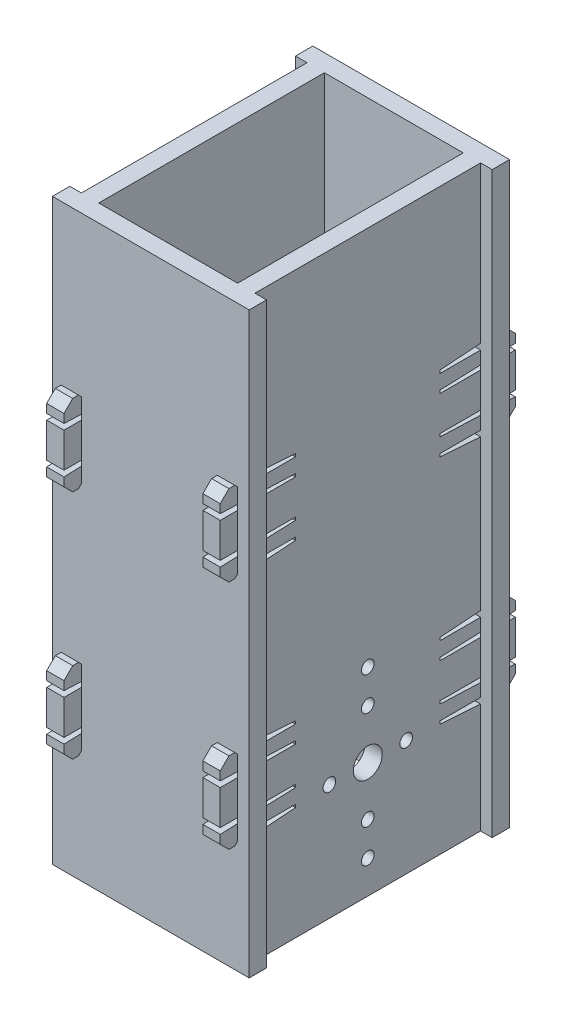
from build123d import *

# Parameters (mm, degrees)
SKETCH3_R           = 1.0922
SKETCH3_R_2         = 2.5
BOSS_EXTRUDE2_DEPTH = 3
SKETCH6_W           = 34
SKETCH6_H           = 100
SKETCH6_W_2         = 3
SKETCH6_H_2         = 12
BOSS_EXTRUDE3_DEPTH = 3


with BuildPart() as part:
    # Sketch3 → Boss-Extrude2 (new body)
    with BuildSketch(Plane.ZY.offset(-3)):
        Polygon((-42, 0), (-3, 0), (-3, 19), (-10, 19.5), (-10, 20), (-1, 20), (0, 19.5), (0.5, 19), (1.5, 19), (3, 20.5), (3, 22), (-10, 22.5), (-10, 23), (3, 23), (3, 29), (-10, 29), (-10, 29.5), (3, 30), (3, 31.5), (1.5, 33), (0.5, 33), (0, 32.5), (-1, 32), (-10, 32), (-10, 32.5), (-3, 33), (-3, 59), (-10, 59.5), (-10, 60), (-1, 60), (0, 59.5), (0.5, 59), (1.5, 59), (3, 60.5), (3, 62), (-10, 62.5), (-10, 63), (3, 63), (3, 69), (-10, 69), (-10, 69.5), (3, 70), (3, 71.5), (1.5, 73), (0.5, 73), (0, 72.5), (-1, 72), (-10, 72), (-10, 72.5), (-3, 73), (-3, 100), (-42, 100), (-42, 73), (-35, 72.5), (-35, 72), (-44, 72), (-45, 72.5), (-45.5, 73), (-46.5, 73), (-48, 71.5), (-48, 70), (-35, 69.5), (-35, 69), (-48, 69), (-48, 63), (-35, 63), (-35, 62.5), (-48, 62), (-48, 60.5), (-46.5, 59), (-45.5, 59), (-45, 59.5), (-44, 60), (-35, 60), (-35, 59.5), (-42, 59), (-42, 33), (-35, 32.5), (-35, 32), (-44, 32), (-45, 32.5), (-45.5, 33), (-46.5, 33), (-48, 31.5), (-48, 30), (-35, 29.5), (-35, 29), (-48, 29), (-48, 23), (-35, 23), (-35, 22.5), (-48, 22), (-48, 20.5), (-46.5, 19), (-45.5, 19), (-45, 19.5), (-44, 20), (-35, 20), (-35, 19.5), (-42, 19), align=None)
        with Locations((-29.132509448, 20)):
            Circle(SKETCH3_R, mode=Mode.SUBTRACT)
        with Locations((-22.5, 5.7)):
            Circle(SKETCH3_R, mode=Mode.SUBTRACT)
        with Locations((-22.5, 11.5)):
            Circle(SKETCH3_R, mode=Mode.SUBTRACT)
        with Locations((-22.5, 28.5)):
            Circle(SKETCH3_R, mode=Mode.SUBTRACT)
        with Locations((-22.5, 34.3)):
            Circle(SKETCH3_R, mode=Mode.SUBTRACT)
        with Locations((-15.867490552, 20)):
            Circle(SKETCH3_R, mode=Mode.SUBTRACT)
        with Locations((-22.5, 20)):
            Circle(SKETCH3_R_2, mode=Mode.SUBTRACT)
    boss_extrude2 = extrude(amount=BOSS_EXTRUDE2_DEPTH)

    # Sketch6 → Boss-Extrude3 (add)
    with BuildSketch(Plane.XY.offset(-3)):
        with Locations((15, 50)):
            Rectangle(SKETCH6_W, SKETCH6_H)
        with Locations((28.5, 66)):
            Rectangle(SKETCH6_W_2, SKETCH6_H_2, mode=Mode.SUBTRACT)
        with Locations((1.5, 26)):
            Rectangle(SKETCH6_W_2, SKETCH6_H_2, mode=Mode.SUBTRACT)
        with Locations((1.5, 66)):
            Rectangle(SKETCH6_W_2, SKETCH6_H_2, mode=Mode.SUBTRACT)
        with Locations((28.5, 26)):
            Rectangle(SKETCH6_W_2, SKETCH6_H_2, mode=Mode.SUBTRACT)
    boss_extrude3 = extrude(amount=BOSS_EXTRUDE3_DEPTH)

    # Mirror3: Boss-Extrude3 across plane
    add(boss_extrude3.mirror(Plane(origin=(0, 0, -22.5), x_dir=(1, 0, 0), z_dir=(0, 0, -1))))

    # Mirror4: Boss-Extrude2 across plane
    add(boss_extrude2.mirror(Plane(origin=(15, 0, 0), x_dir=(0, 0, 1), z_dir=(1, 0, 0))))


solid = part.part
